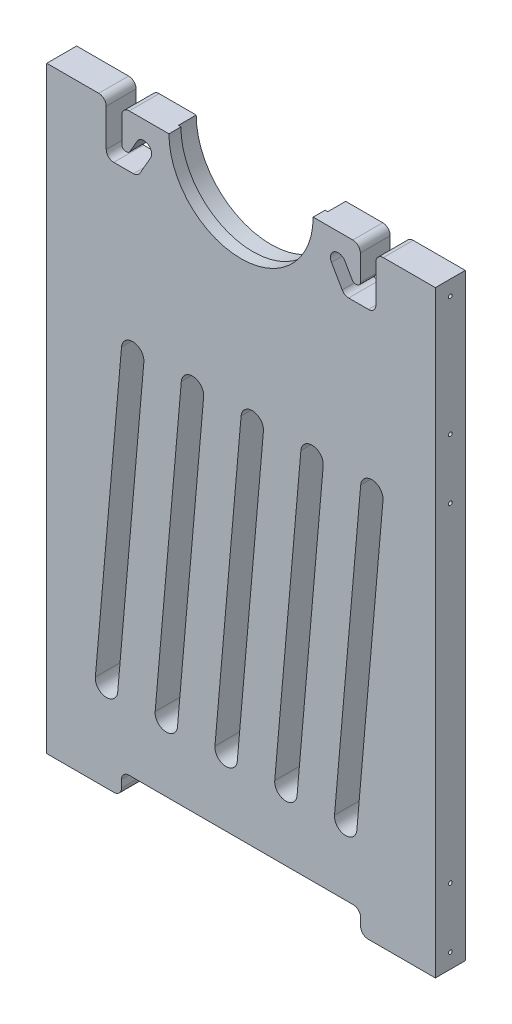
from build123d import *

# Parameters (mm, degrees)
SKETCH1_W                          = 165.1
SKETCH1_H                          = 12.7
BOSS_EXTRUDE1_DEPTH                = 127
SKETCH2_R                          = 30.63494
CUT_EXTRUDE1_DEPTH                 = 153.002606886
SKETCH3_R                          = 31.75
CUT_EXTRUDE2_DEPTH                 = 7.62
CUT_EXTRUDE3_DEPTH                 = 153.002606886
FILLET1_R                          = 3.175
FILLET2_R                          = 1.5875
SKETCH5_W                          = 101.6
SKETCH5_H                          = 9.525
CUT_EXTRUDE4_DEPTH                 = 153.002606886
FILLET3_R                          = 3.175
F_1_16_0_0625_DIAMETER_HOLE1_D     = 1.5875
F_1_16_0_0625_DIAMETER_HOLE1_DEPTH = 15.875
F_1_16_0_0625_DIAMETER_HOLE1_TIP   = 0.476933116
F_1_16_0_0625_DIAMETER_HOLE2_D     = 1.5875
F_1_16_0_0625_DIAMETER_HOLE2_DEPTH = 15.875
F_1_16_0_0625_DIAMETER_HOLE2_TIP   = 0.476933116
CUT_EXTRUDE5_DEPTH                 = 153.002606886


with BuildPart() as part:
    # Sketch1 → Boss-Extrude1 (new, symmetric)
    with BuildSketch(Plane(origin=(0, 0, 0), x_dir=(1, 0, 0), z_dir=(0, 1, 0))):
        Rectangle(SKETCH1_W, SKETCH1_H)
    extrude(amount=BOSS_EXTRUDE1_DEPTH, both=True)

    # Sketch2 → Cut-Extrude1 (cut, through all)
    with BuildSketch(Plane.XY.offset(6.35)):
        with Locations((0, 127)):
            Circle(SKETCH2_R)
    extrude(amount=-CUT_EXTRUDE1_DEPTH, mode=Mode.SUBTRACT)

    # Sketch3 → Cut-Extrude2 (cut)
    with BuildSketch(Plane(origin=(0, 0, -6.35), x_dir=(-1, 0, 0), z_dir=(0, 0, -1))):
        with Locations((0, 127)):
            Circle(SKETCH3_R)
    extrude(amount=-CUT_EXTRUDE2_DEPTH, mode=Mode.SUBTRACT)

    # Sketch4 → Cut-Extrude3 (cut, through all)
    with BuildSketch(Plane.XY.offset(6.35)):
        with BuildLine():
            Line((57.277, 127), (57.277, 104.775))
            Line((57.277, 104.775), (43.877983689, 104.775))
            Line((43.877983689, 104.775), (38.415383769, 114.236500603))
            ThreePointArc((38.415383769, 114.236500603), (39.624000301, 118.747116057), (44.134615883, 117.5385))
            Line((44.134615883, 117.5385), (47.690804866, 111.379))
            Line((47.690804866, 111.379), (50.673, 111.379))
            Line((50.673, 111.379), (50.673, 127))
            Line((50.673, 127), (57.277, 127))
        make_face()
        with BuildLine():
            Line((-50.673, 127), (-57.277, 127))
            Line((-57.277, 127), (-57.277, 104.775))
            Line((-57.277, 104.775), (-43.877983689, 104.775))
            Line((-43.877983689, 104.775), (-38.415383769, 114.236500603))
            ThreePointArc((-38.415383769, 114.236500603), (-39.624000301, 118.747116057), (-44.134615883, 117.5385))
            Line((-44.134615883, 117.5385), (-47.690804866, 111.379))
            Line((-47.690804866, 111.379), (-50.673, 111.379))
            Line((-50.673, 111.379), (-50.673, 127))
        make_face()
    extrude(amount=-CUT_EXTRUDE3_DEPTH, mode=Mode.SUBTRACT)

    # Fillet1
    fillet1_edges = [part.edges().sort_by_distance(p)[0] for p in [
        (50.673, 127, 0),
        (57.277, 127, 0),
        (57.277, 104.775, 0),
        (43.877983689, 104.775, 0),
        (-43.877983689, 104.775, 0),
        (-57.277, 104.775, 0),
        (-57.277, 127, 0),
        (-50.673, 127, 0),
    ]]
    fillet(fillet1_edges, radius=FILLET1_R)

    # Fillet2
    fillet2_edges = [part.edges().sort_by_distance(p)[0] for p in [
        (47.690804866, 111.379, 0),
        (50.673, 111.379, 0),
        (-50.673, 111.379, 0),
        (-47.690804866, 111.379, 0),
    ]]
    fillet(fillet2_edges, radius=FILLET2_R)

    # Sketch5 → Cut-Extrude4 (cut, through all)
    with BuildSketch(Plane.XY.offset(6.35)):
        with Locations((0, -122.2375)):
            Rectangle(SKETCH5_W, SKETCH5_H)
    extrude(amount=-CUT_EXTRUDE4_DEPTH, mode=Mode.SUBTRACT)

    # Fillet3
    fillet3_edges = [part.edges().sort_by_distance(p)[0] for p in [
        (-50.8, -127, 0),
        (-50.8, -117.475, 0),
        (50.8, -117.475, 0),
        (50.8, -127, 0),
    ]]
    fillet(fillet3_edges, radius=FILLET3_R)

    # 1/16 (0.0625) Diameter Hole1
    with Locations(Plane(origin=(82.55, 0, 0), x_dir=(0, 0, -1), z_dir=(1, 0, 0))):
        with Locations((0, -120.65), (0, -95.25), (0, 44.45), (0, 69.85), (0, 120.65)):
            Hole(F_1_16_0_0625_DIAMETER_HOLE1_D / 2, depth=F_1_16_0_0625_DIAMETER_HOLE1_DEPTH)
            with Locations((0, 0, -(F_1_16_0_0625_DIAMETER_HOLE1_DEPTH + F_1_16_0_0625_DIAMETER_HOLE1_TIP / 2))):  # 118° drill point
                Cone(0, F_1_16_0_0625_DIAMETER_HOLE1_D / 2, F_1_16_0_0625_DIAMETER_HOLE1_TIP, mode=Mode.SUBTRACT)

    # 1/16 (0.0625) Diameter Hole2
    with Locations(Plane.ZY.offset(82.55)):
        with Locations((0, -120.65), (0, -95.25), (0, 44.45), (0, 69.85), (0, 120.65)):
            Hole(F_1_16_0_0625_DIAMETER_HOLE2_D / 2, depth=F_1_16_0_0625_DIAMETER_HOLE2_DEPTH)
            with Locations((0, 0, -(F_1_16_0_0625_DIAMETER_HOLE2_DEPTH + F_1_16_0_0625_DIAMETER_HOLE2_TIP / 2))):  # 118° drill point
                Cone(0, F_1_16_0_0625_DIAMETER_HOLE2_D / 2, F_1_16_0_0625_DIAMETER_HOLE2_TIP, mode=Mode.SUBTRACT)

    # Sketch10 → Cut-Extrude5 (cut, through all)
    with BuildSketch(Plane.XY.offset(6.35)):
        with BuildLine():
            Line((-61.89437725, -88.484920775), (-50.783316982, 38.515079225))
            ThreePointArc((-50.783316982, 38.515079225), (-45.623860507, 42.84437725), (-41.294562483, 37.684920775))
            Line((-41.294562483, 37.684920775), (-52.40562275, -89.315079225))
            ThreePointArc((-52.40562275, -89.315079225), (-57.565079225, -93.64437725), (-61.89437725, -88.484920775))
        make_face()
        with BuildLine():
            Line((-27.00562275, -89.315079225), (-15.894562483, 37.684920775))
            ThreePointArc((-15.894562483, 37.684920775), (-20.223860507, 42.84437725), (-25.383316982, 38.515079225))
            Line((-25.383316982, 38.515079225), (-36.49437725, -88.484920775))
            ThreePointArc((-36.49437725, -88.484920775), (-32.165079225, -93.64437725), (-27.00562275, -89.315079225))
        make_face()
        with BuildLine():
            Line((-1.60562275, -89.315079225), (9.505437517, 37.684920775))
            ThreePointArc((9.505437517, 37.684920775), (5.176139493, 42.84437725), (0.016683018, 38.515079225))
            Line((0.016683018, 38.515079225), (-11.09437725, -88.484920775))
            ThreePointArc((-11.09437725, -88.484920775), (-6.765079225, -93.64437725), (-1.60562275, -89.315079225))
        make_face()
        with BuildLine():
            Line((23.79437725, -89.315079225), (34.905437517, 37.684920775))
            ThreePointArc((34.905437517, 37.684920775), (30.576139493, 42.84437725), (25.416683018, 38.515079225))
            Line((25.416683018, 38.515079225), (14.30562275, -88.484920775))
            ThreePointArc((14.30562275, -88.484920775), (18.634920775, -93.64437725), (23.79437725, -89.315079225))
        make_face()
        with BuildLine():
            Line((49.19437725, -89.315079225), (60.305437517, 37.684920775))
            ThreePointArc((60.305437517, 37.684920775), (55.976139493, 42.84437725), (50.816683018, 38.515079225))
            Line((50.816683018, 38.515079225), (39.70562275, -88.484920775))
            ThreePointArc((39.70562275, -88.484920775), (44.034920775, -93.64437725), (49.19437725, -89.315079225))
        make_face()
    extrude(amount=-CUT_EXTRUDE5_DEPTH, mode=Mode.SUBTRACT)


solid = part.part
